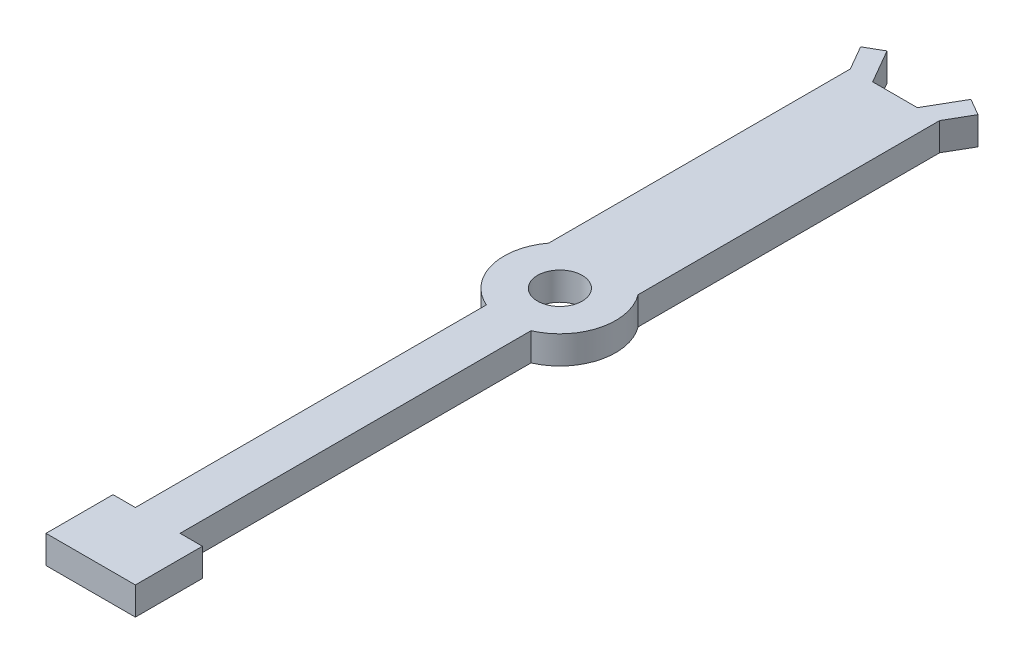
from build123d import *

# Parameters (mm, degrees)
SKETCH1_R           = 2
BOSS_EXTRUDE1_DEPTH = 2.5


with BuildPart() as part:
    # Sketch1 → Boss-Extrude1 (new body)
    with BuildSketch(Plane(origin=(0, 0, 0), x_dir=(1, 0, 0), z_dir=(0, 1, 0))):
        with BuildLine():
            Line((-2, -4.582575695), (-2, -36))
            Line((-2, -36), (-4, -36))
            Line((-4, -36), (-4, -42))
            Line((-4, -42), (4, -42))
            Line((4, -42), (4, -36))
            Line((4, -36), (2, -36))
            Line((2, -36), (2, -4.582575695))
            ThreePointArc((2, -4.582575695), (4.83465237, -1.275200556), (4, 3))
            Line((4, 3), (4, 30))
            Line((4, 30), (5.25505198, 32.173813795))
            Line((5.25505198, 32.173813795), (3.75505198, 33.039839198))
            Line((3.75505198, 33.039839198), (2, 30))
            Line((2, 30), (-2, 30))
            Line((-2, 30), (-3.75505198, 33.039839198))
            Line((-3.75505198, 33.039839198), (-5.25505198, 32.173813795))
            Line((-5.25505198, 32.173813795), (-4, 30))
            Line((-4, 30), (-4, 3))
            ThreePointArc((-4, 3), (-4.83465237, -1.275200556), (-2, -4.582575695))
        make_face()
        with Locations(Location((0, 0, 0), (0, 0, 270))):
            Circle(SKETCH1_R, mode=Mode.SUBTRACT)
    extrude(amount=BOSS_EXTRUDE1_DEPTH)


solid = part.part
